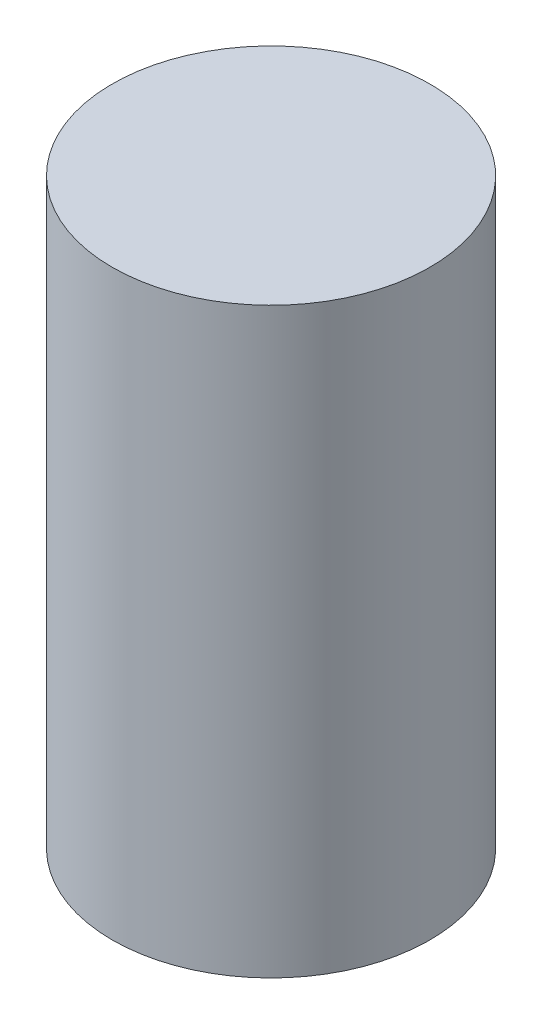
from build123d import *

# Parameters (mm, degrees)
SKETCH1_R           = 19
BOSS_EXTRUDE1_DEPTH = 69.7


with BuildPart() as part:
    # Sketch1 → Boss-Extrude1 (new body)
    with BuildSketch(Plane(origin=(0, 0, 0), x_dir=(1, 0, 0), z_dir=(0, 1, 0))):
        with Locations(Location((0, 0, 0), (0, 0, 270))):
            Circle(SKETCH1_R)
    extrude(amount=BOSS_EXTRUDE1_DEPTH)


solid = part.part
